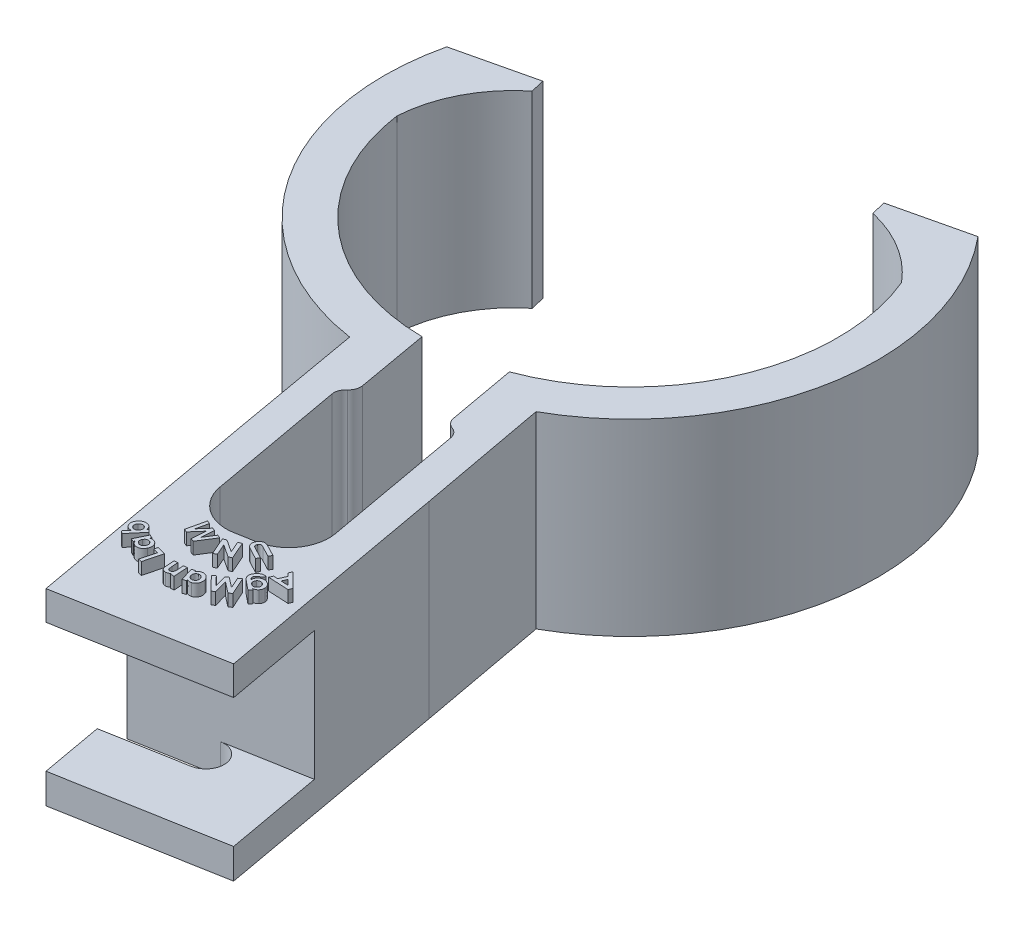
from build123d import *

# Parameters (mm, degrees)
BOSS_EXTRUDE6_DEPTH = 47
SKETCH13_W          = 40.343621174
SKETCH13_H          = 7.5
SKETCH13_H_2        = 7.3
BOSS_EXTRUDE7_DEPTH = 25
CUT_EXTRUDE4_DEPTH  = 25
BOSS_EXTRUDE8_DEPTH = 3
CUT_EXTRUDE6_DEPTH  = 1


with BuildPart() as part:
    # Sketch2 → Boss-Extrude6 (new body)
    with BuildSketch(Plane(origin=(0, 0, 0), x_dir=(1, 0, 0), z_dir=(0, 1, 0))):
        with BuildLine():
            Line((21.616767651, -30.12337147), (2.207227705, -34.69426381))
            ThreePointArc((2.207227705, -34.69426381), (11.158636297, -83.205582289), (52.844737245, -109.582555657))
            Line((52.844737245, -109.582555657), (58.60163644, -142.366081476))
            Line((58.60163644, -142.366081476), (64.895817981, -177.296582688))
            Line((64.895817981, -177.296582688), (104.60001041, -170.142222274))
            Line((104.60001041, -170.142222274), (98.305828869, -135.211721063))
            Line((98.305828869, -135.211721063), (92.25495319, -102.44626102))
            ThreePointArc((92.25495319, -102.44626102), (122.71490473, -59.986311861), (109.583052227, -9.407557624))
            Line((109.583052227, -9.407557624), (90.562090244, -13.886940941))
            Line((90.562090244, -13.886940941), (91.408224888, -17.47991206))
            ThreePointArc((91.408224888, -17.47991206), (101.619964374, -21.669899318), (109.972651715, -28.885731268))
            ThreePointArc((109.972651715, -28.885731268), (109.63860953, -69.322629119), (80.318906443, -97.172392186))
            Line((80.318906443, -97.172392186), (83.379216775, -114.155994828))
            ThreePointArc((83.379216775, -114.155994828), (84.040774134, -115.560944533), (85.316174374, -116.446888121))
            ThreePointArc((85.316174374, -116.446888121), (86.591575083, -117.332832261), (87.25313223, -118.737782838))
            Line((87.25313223, -118.737782838), (88.449913494, -125.379499334))
            Line((88.449913494, -125.379499334), (93.583336908, -153.868199831))
            ThreePointArc((93.583336908, -153.868199831), (91.954779092, -161.346598269), (85.515188569, -165.483060243))
            Line((85.515188569, -165.483060243), (80.718257555, -166.34742673))
            ThreePointArc((80.718257555, -166.34742673), (73.239859117, -164.718868914), (69.103397144, -158.279278391))
            Line((69.103397144, -158.279278391), (63.969973729, -129.790577894))
            Line((63.969973729, -129.790577894), (62.946566655, -124.111027375))
            ThreePointArc((62.946566655, -124.111027375), (63.076116611, -122.56352663), (63.962060397, -121.288126553))
            ThreePointArc((63.962060397, -121.288126553), (64.846046762, -120.018151398), (64.979577792, -118.476581338))
            Line((64.979577792, -118.476581338), (61.804045473, -100.456781006))
            ThreePointArc((61.804045473, -100.456781006), (28.076907465, -87.636520169), (10.926688095, -55.89145911))
            ThreePointArc((10.926688095, -55.89145911), (14.320642098, -43.523605025), (22.433244924, -33.590407462))
            Line((22.433244924, -33.590407462), (21.616767651, -30.12337147))
        make_face()
    extrude(amount=BOSS_EXTRUDE6_DEPTH)

    # Sketch13 → Boss-Extrude7 (add)
    with BuildSketch(Plane(origin=(32.983508727, 0, 183.046911508), x_dir=(0.9841504375270943, 0, -0.17733560363116313), z_dir=(0.17733560363116313, 0, 0.9841504375270943))):
        with Locations((52.598061734, 3.75)):
            Rectangle(SKETCH13_W, SKETCH13_H)
        with Locations((52.598061734, 43.35)):
            Rectangle(SKETCH13_W, SKETCH13_H_2)
    extrude(amount=BOSS_EXTRUDE7_DEPTH)

    # Sketch14 → Cut-Extrude4 (cut)
    with BuildSketch(Plane(origin=(0, 7.5, 0), x_dir=(1, 0, 0), z_dir=(0, 1, 0))):
        with BuildLine():
            Line((64.895817981, -177.296582688), (84.747914196, -173.719402481))
            ThreePointArc((84.747914196, -173.719402481), (90.05877622, -177.408540456), (86.369638245, -182.719402481))
            Line((86.369638245, -182.719402481), (66.51754203, -186.296582688))
            Line((66.51754203, -186.296582688), (64.895817981, -177.296582688))
        make_face()
    extrude(amount=-CUT_EXTRUDE4_DEPTH, mode=Mode.SUBTRACT)

    # Sketch15 → Boss-Extrude8 (add)
    # profile 1 of 11: a face of its own
    with BuildSketch(Plane(origin=(0, 47, 0), x_dir=(1, 0, 0), z_dir=(0, 1, 0))):
        Polygon((103.131089791, -174.061415074), (102.759973505, -174.89905029), (97.677874647, -174.645279256), (98.058531197, -173.786655458), (99.103190151, -173.842943018), (99.887399887, -172.072269942), (99.150891474, -171.322405158), (99.531548024, -170.46378136), align=None)
        Polygon((101.791636666, -173.975552694), (100.558080476, -172.737226372), (100.045768276, -173.891598367), align=None, mode=Mode.SUBTRACT)
    # profile 2 of 11: a face of its own
    with BuildSketch(Plane(origin=(0, 47, 0), x_dir=(1, 0, 0), z_dir=(0, 1, 0))):
        with BuildLine():
            Line((98.434764, -179.340757898), (97.881428664, -180.021932778))
            Line((97.881428664, -180.021932778), (95.547879986, -178.126282237))
            add(Edge.make_bspline(
                [(95.547879986, -178.126282237), (95.49262528, -178.080173686), (95.385900681, -177.991114907), (95.240154198, -177.851577211), (95.113939052, -177.711700262), (95.004398912, -177.573849013), (94.91348911, -177.435968968), (94.84280907, -177.297925003), (94.788253865, -177.16075703), (94.767278949, -177.06733653), (94.756992065, -177.021519617)],
                knots=[0, 0, 0, 0, 1.245890263, 2.406440056, 3.49025294, 4.505912215, 5.452835617, 6.344342255, 7.188003406, 8, 8, 8, 8], degree=3))
            add(Edge.make_bspline(
                [(94.756992065, -177.021519617), (94.747649854, -176.960606268), (94.729037447, -176.839249131), (94.731670478, -176.654040109), (94.755207077, -176.468492987), (94.8040957, -176.282384277), (94.875167925, -176.095655364), (94.96995744, -175.908688123), (95.087350516, -175.720845961), (95.18101065, -175.6014118), (95.229235154, -175.539916552)],
                knots=[0, 0, 0, 0, 0.919071591, 1.831058366, 2.755441493, 3.707028417, 4.697703049, 5.734317248, 6.83342655, 8, 8, 8, 8], degree=3))
            add(Edge.make_bspline(
                [(95.229235154, -175.539916552), (95.282327691, -175.476710114), (95.384472702, -175.355106916), (95.547305345, -175.19376925), (95.708248114, -175.05649453), (95.871372276, -174.946154627), (96.035924262, -174.859853208), (96.202114609, -174.792536018), (96.372074537, -174.747787419), (96.544603082, -174.722740605), (96.719103988, -174.718047968), (96.894512202, -174.733435768), (97.07084904, -174.769462973), (97.185075929, -174.80966796), (97.243184974, -174.830120879)],
                knots=[0, 0, 0, 0, 1.289499851, 2.480875545, 3.577954968, 4.591129442, 5.551536002, 6.477223281, 7.387410485, 8.291306844, 9.196200121, 10.109191889, 11.038115683, 12, 12, 12, 12], degree=3))
            Line((97.243184974, -174.830120879), (96.630699998, -175.583801769))
            add(Edge.make_bspline(
                [(96.630699998, -175.583801769), (96.59813572, -175.586056949), (96.532586706, -175.590596428), (96.435398769, -175.614562324), (96.33956703, -175.651295192), (96.244883727, -175.700272187), (96.15126934, -175.762019969), (96.06032646, -175.837966794), (95.969824589, -175.925901423), (95.914279547, -175.992229352), (95.885605346, -176.026470038)],
                knots=[0, 0, 0, 0, 0.874978427, 1.761254308, 2.674544752, 3.625293698, 4.617420731, 5.678829307, 6.801734371, 8, 8, 8, 8], degree=3))
            add(Edge.make_bspline(
                [(95.885605346, -176.026470038), (95.851019056, -176.071003595), (95.785066751, -176.155924256), (95.704573354, -176.286875157), (95.644303525, -176.412807177), (95.607877214, -176.534702107), (95.5904492, -176.650389718), (95.588723895, -176.759105846), (95.604123771, -176.860967918), (95.630297438, -176.941247091), (95.662646837, -177.002826002), (95.694861225, -177.051521048), (95.733504259, -177.104179443), (95.781990146, -177.157830236), (95.836360549, -177.215761393), (95.899643263, -177.275690629), (95.971072648, -177.338135196), (96.021626382, -177.380335779), (96.047789841, -177.402176168)],
                knots=[0, 0, 0, 0, 1.668457493, 3.181567445, 4.542185934, 5.790354604, 6.932873067, 7.996883218, 8.996938763, 9.97058257, 10.480159794, 11.05211696, 11.698033319, 12.41194827, 13.191175115, 14.050272592, 14.990942715, 16, 16, 16, 16], degree=3))
            add(Edge.make_bspline(
                [(96.047789841, -177.402176168), (96.04358753, -177.349105459), (96.035389394, -177.245571764), (96.040472981, -177.093419533), (96.059096079, -176.9494703), (96.093003851, -176.812461472), (96.142476118, -176.680528885), (96.206955076, -176.551221611), (96.286625524, -176.423731029), (96.348879028, -176.342704927), (96.38074507, -176.301229653)],
                knots=[0, 0, 0, 0, 1.078430529, 2.103870481, 3.079345661, 4.015832006, 4.958157072, 5.929662638, 6.94024509, 8, 8, 8, 8], degree=3))
            add(Edge.make_bspline(
                [(96.38074507, -176.301229653), (96.418278483, -176.257080089), (96.492150579, -176.170186289), (96.61794174, -176.056892491), (96.749322231, -175.956641128), (96.889962901, -175.873069258), (97.0384376, -175.805194525), (97.195081736, -175.752364303), (97.359762501, -175.71538731), (97.530646219, -175.693670597), (97.703796821, -175.687734847), (97.875784061, -175.69913707), (98.044825443, -175.728124375), (98.210871246, -175.773675856), (98.373573845, -175.837725416), (98.533124172, -175.918316501), (98.690400211, -176.015401473), (98.789072949, -176.092294687), (98.839271212, -176.131412947)],
                knots=[0, 0, 0, 0, 1.009761267, 1.987380712, 2.945913594, 3.888667412, 4.834370373, 5.788624284, 6.766935915, 7.773523073, 8.789178766, 9.784329507, 10.774691632, 11.775930393, 12.782334123, 13.819276532, 14.890589914, 16, 16, 16, 16], degree=3))
            add(Edge.make_bspline(
                [(98.839271212, -176.131412947), (98.890940946, -176.175389825), (98.992303902, -176.261661343), (99.127892117, -176.403078532), (99.244908147, -176.550994848), (99.345408459, -176.703845613), (99.425818658, -176.86414838), (99.487709872, -177.030264454), (99.534323457, -177.201651337), (99.548580359, -177.319234752), (99.55574507, -177.378325507)],
                knots=[0, 0, 0, 0, 1.101110583, 2.160100602, 3.17450141, 4.159786826, 5.124967143, 6.079161231, 7.034695401, 8, 8, 8, 8], degree=3))
            add(Edge.make_bspline(
                [(99.55574507, -177.378325507), (99.559296575, -177.43204323), (99.566272818, -177.537561286), (99.559322601, -177.694529851), (99.537331453, -177.846594865), (99.500909408, -177.994223349), (99.450346878, -178.137367507), (99.383701604, -178.275031386), (99.303730157, -178.408663559), (99.239865053, -178.491636287), (99.207525418, -178.533651528)],
                knots=[0, 0, 0, 0, 1.042406616, 2.047605787, 3.037430777, 4.014712394, 4.989076456, 5.972881294, 6.973519569, 8, 8, 8, 8], degree=3))
            add(Edge.make_bspline(
                [(99.207525418, -178.533651528), (99.17481301, -178.571493567), (99.11000284, -178.646466614), (99.001487409, -178.747074975), (98.884678322, -178.835060111), (98.759027727, -178.911663096), (98.622180136, -178.975979239), (98.472215724, -179.028330037), (98.308316793, -179.069371163), (98.193569547, -179.087272307), (98.134245671, -179.096527129)],
                knots=[0, 0, 0, 0, 0.964560943, 1.910998314, 2.848523608, 3.781883668, 4.745253494, 5.760155555, 6.8420092, 8, 8, 8, 8], degree=3))
            Line((98.134245671, -179.096527129), (98.434764, -179.340757898))
        make_face()
        with BuildLine():
            add(Edge.make_bspline(
                [(98.441442185, -178.170167454), (98.462291368, -178.143177128), (98.503220833, -178.090191856), (98.555086361, -178.005985359), (98.595940434, -177.919279887), (98.629322045, -177.831530721), (98.650612099, -177.741006673), (98.664807139, -177.649126855), (98.667048891, -177.555038547), (98.660727829, -177.460073885), (98.643769529, -177.366137029), (98.621310794, -177.273987207), (98.585290312, -177.186998257), (98.544402214, -177.10228596), (98.491352098, -177.023300672), (98.432890944, -176.945775978), (98.362213878, -176.874756833), (98.311023258, -176.830388505), (98.284981849, -176.807817694)],
                knots=[0, 0, 0, 0, 1.065665555, 2.09203029, 3.083576218, 4.058589778, 5.020594072, 5.985009344, 6.959668104, 7.956184716, 8.954732157, 9.940881604, 10.913713639, 11.891763056, 12.876107102, 13.882245919, 14.922667826, 16, 16, 16, 16], degree=3))
            add(Edge.make_bspline(
                [(98.284981849, -176.807817694), (98.256738695, -176.785975407), (98.201252747, -176.743064477), (98.113097532, -176.68900329), (98.023723932, -176.643272468), (97.932305852, -176.608044738), (97.839274431, -176.582791276), (97.744491949, -176.56893597), (97.648366927, -176.562616727), (97.551172441, -176.567786669), (97.455375894, -176.582013709), (97.362647008, -176.604782042), (97.27394087, -176.636422057), (97.18943783, -176.677671129), (97.109509176, -176.728789018), (97.032404578, -176.787218976), (96.959394812, -176.854952978), (96.91605878, -176.906546581), (96.894011296, -176.932795158)],
                knots=[0, 0, 0, 0, 1.094816154, 2.150854411, 3.167619202, 4.171520489, 5.151424491, 6.118811492, 7.10607238, 8.102548541, 9.09888137, 10.073915043, 11.027623138, 11.983325815, 12.952482788, 13.934134193, 14.948977507, 16, 16, 16, 16], degree=3))
            add(Edge.make_bspline(
                [(96.894011296, -176.932795158), (96.873394744, -176.959101849), (96.832775725, -177.010931659), (96.7829119, -177.094267588), (96.740711738, -177.178378051), (96.71076282, -177.265614399), (96.686910576, -177.35401001), (96.674988406, -177.445055267), (96.672040554, -177.53773934), (96.678779924, -177.631395339), (96.694789488, -177.724809535), (96.720813656, -177.815459433), (96.755294049, -177.903682901), (96.800461696, -177.988010898), (96.853866994, -178.069929093), (96.918115473, -178.147010679), (96.989055407, -178.223516511), (97.043570049, -178.26900866), (97.071460214, -178.292282838)],
                knots=[0, 0, 0, 0, 1.041142243, 2.051273015, 3.022449126, 3.969587443, 4.921953604, 5.872718237, 6.825084399, 7.80918361, 8.795428516, 9.774720375, 10.745086243, 11.743074639, 12.752377735, 13.788407955, 14.868530275, 16, 16, 16, 16], degree=3))
            add(Edge.make_bspline(
                [(97.071460214, -178.292282838), (97.099785202, -178.313997104), (97.155352496, -178.35659564), (97.242257516, -178.41242524), (97.331124283, -178.457563652), (97.421586137, -178.491644843), (97.512584424, -178.51840036), (97.605522867, -178.533229933), (97.699475581, -178.539104699), (97.793762445, -178.535176667), (97.886894449, -178.522190222), (97.977160648, -178.498715954), (98.064453453, -178.467611242), (98.147609663, -178.426011984), (98.227481722, -178.376266328), (98.303104728, -178.316597618), (98.374881302, -178.247497033), (98.418950279, -178.196298261), (98.441442185, -178.170167454)],
                knots=[0, 0, 0, 0, 1.1082415, 2.174122053, 3.203355073, 4.197583973, 5.173090473, 6.14413629, 7.113925413, 8.092577187, 9.070381234, 10.028633271, 10.984744872, 11.943302296, 12.910724419, 13.902644639, 14.929552671, 16, 16, 16, 16], degree=3))
        make_face(mode=Mode.SUBTRACT)
    # profile 3 of 11: a face of its own
    with BuildSketch(Plane(origin=(0, 47, 0), x_dir=(1, 0, 0), z_dir=(0, 1, 0))):
        Polygon((96.729398936, -182.634954046), (95.993844549, -183.131047796), (93.225259814, -180.994028565), (94.156389621, -184.370328145), (93.432283552, -184.858789683), (90.104639321, -181.360374719), (90.828745391, -180.871913181), (92.934281749, -183.078576342), (92.092830427, -180.019967568), (92.755878804, -179.572529166), (95.265922374, -181.506340765), (94.017101761, -178.722491606), (94.748840042, -178.229259936), align=None)
    # profile 4 of 11: a face of its own
    with BuildSketch(Plane(origin=(0, 47, 0), x_dir=(1, 0, 0), z_dir=(0, 1, 0))):
        with BuildLine():
            Line((88.149768954, -185.654259944), (87.31404179, -185.910893056))
            Line((87.31404179, -185.910893056), (86.286555312, -182.569892456))
            Line((86.286555312, -182.569892456), (87.122282475, -182.313259343))
            Line((87.122282475, -182.313259343), (87.23104149, -182.666249126))
            add(Edge.make_bspline(
                [(87.23104149, -182.666249126), (87.260139586, -182.617082413), (87.316496283, -182.521857159), (87.411735074, -182.391366165), (87.511313659, -182.276356211), (87.617961787, -182.177348948), (87.731730035, -182.092598599), (87.85403757, -182.019932861), (87.984557357, -181.956930407), (88.077188984, -181.926195395), (88.12401024, -181.910660184)],
                knots=[0, 0, 0, 0, 1.140955895, 2.209783996, 3.222920928, 4.176084696, 5.111376395, 6.051769194, 7.015254131, 8, 8, 8, 8], degree=3))
            add(Edge.make_bspline(
                [(88.12401024, -181.910660184), (88.177491579, -181.895805408), (88.283366895, -181.866397877), (88.445393551, -181.843304838), (88.60688139, -181.835818561), (88.767678092, -181.848145425), (88.928045451, -181.87541333), (89.087337908, -181.9217114), (89.24508703, -181.986883179), (89.401477524, -182.065831363), (89.5508132, -182.160627268), (89.69020614, -182.267747601), (89.816779222, -182.387653561), (89.930748051, -182.520053094), (90.032521838, -182.664570283), (90.11994192, -182.822453263), (90.197141332, -182.991282482), (90.23697795, -183.110414696), (90.257213365, -183.170929114)],
                knots=[0, 0, 0, 0, 0.965835011, 1.912033005, 2.843313872, 3.776158024, 4.714935254, 5.67199629, 6.658321753, 7.683788248, 8.719419839, 9.734181232, 10.741052379, 11.750297076, 12.7721076, 13.813587427, 14.889389511, 16, 16, 16, 16], degree=3))
            add(Edge.make_bspline(
                [(90.257213365, -183.170929114), (90.275093214, -183.234279728), (90.310194017, -183.358646403), (90.344475684, -183.546340643), (90.362051148, -183.729891847), (90.362263775, -183.90912879), (90.345140165, -184.08397587), (90.310501099, -184.254222746), (90.259742682, -184.420508795), (90.192387102, -184.580533972), (90.110687396, -184.731339828), (90.017923895, -184.870414563), (89.914849053, -184.996551044), (89.798983257, -185.107802657), (89.673105289, -185.206639094), (89.53543494, -185.290596685), (89.387731418, -185.362477508), (89.282963486, -185.397803065), (89.229726886, -185.415753333)],
                knots=[0, 0, 0, 0, 1.145736254, 2.249250627, 3.317120969, 4.352641516, 5.365391375, 6.371031144, 7.372974538, 8.388053151, 9.389062661, 10.355106048, 11.295266053, 12.219488455, 13.146642511, 14.076438695, 15.02256483, 16, 16, 16, 16], degree=3))
            add(Edge.make_bspline(
                [(89.229726886, -185.415753333), (89.18003591, -185.429532916), (89.081329641, -185.456904711), (88.930242778, -185.478983623), (88.779411784, -185.487345471), (88.629144736, -185.478233476), (88.479113302, -185.454507201), (88.330098672, -185.413740742), (88.181095082, -185.358473887), (88.085118944, -185.310458976), (88.036239807, -185.286005737)],
                knots=[0, 0, 0, 0, 1.002346291, 1.991062953, 2.96364028, 3.936552066, 4.913997217, 5.913494597, 6.937375622, 8, 8, 8, 8], degree=3))
            Line((88.036239807, -185.286005737), (88.149768954, -185.654259944))
        make_face()
        with BuildLine():
            add(Edge.make_bspline(
                [(88.819495516, -184.694509343), (88.85089998, -184.683995108), (88.912951567, -184.663220198), (89.000363597, -184.621922169), (89.081966788, -184.573955574), (89.15562768, -184.517615809), (89.223913873, -184.455109992), (89.283571249, -184.384018762), (89.337643487, -184.306294028), (89.3836297, -184.221607327), (89.423349254, -184.132664161), (89.451195882, -184.039488148), (89.472319701, -183.944566101), (89.480830255, -183.846907685), (89.482678742, -183.747239483), (89.471901769, -183.645538837), (89.454687885, -183.540871361), (89.434618098, -183.471596688), (89.424348281, -183.436148465)],
                knots=[0, 0, 0, 0, 1.015989207, 2.007477124, 2.961882744, 3.916737695, 4.849371931, 5.798218297, 6.759639321, 7.751559773, 8.752805912, 9.744101532, 10.732170598, 11.732797728, 12.748223852, 13.787724671, 14.867966786, 16, 16, 16, 16], degree=3))
            add(Edge.make_bspline(
                [(89.424348281, -183.436148465), (89.412453169, -183.400982787), (89.389195342, -183.332225361), (89.346370582, -183.234073095), (89.295384551, -183.144490853), (89.238922485, -183.061279217), (89.174893419, -182.985870842), (89.10403055, -182.91805541), (89.0268675, -182.857100836), (88.943560649, -182.80443766), (88.856554571, -182.759575028), (88.767207393, -182.725113673), (88.677109591, -182.700133054), (88.585718465, -182.684367118), (88.492876445, -182.679958015), (88.398974121, -182.684909218), (88.303804965, -182.698707369), (88.241509473, -182.716408978), (88.209872619, -182.725398766)],
                knots=[0, 0, 0, 0, 1.132900767, 2.215095631, 3.262603083, 4.274979311, 5.280491259, 6.275973029, 7.264425546, 8.276941377, 9.279779024, 10.247811145, 11.194534946, 12.129692445, 13.072526608, 14.025055084, 14.997021423, 16, 16, 16, 16], degree=3))
            add(Edge.make_bspline(
                [(88.209872619, -182.725398766), (88.177855125, -182.73628039), (88.114971778, -182.757652238), (88.02567547, -182.798959997), (87.943546903, -182.847580005), (87.867880778, -182.903638738), (87.799504056, -182.967398223), (87.737779165, -183.038734412), (87.683545538, -183.117333696), (87.635927095, -183.201803557), (87.596643186, -183.29154238), (87.567365374, -183.385010319), (87.546730155, -183.481100507), (87.537607003, -183.58030883), (87.537593774, -183.682197816), (87.547558044, -183.78685187), (87.566207622, -183.894305158), (87.586836821, -183.965482454), (87.597387644, -184.001886145)],
                knots=[0, 0, 0, 0, 1.021701037, 2.006652379, 2.967813816, 3.902210814, 4.847668477, 5.78817722, 6.748184224, 7.729516742, 8.715358998, 9.703448404, 10.685722158, 11.680522559, 12.709119598, 13.761343169, 14.855036954, 16, 16, 16, 16], degree=3))
            add(Edge.make_bspline(
                [(87.597387644, -184.001886145), (87.609327491, -184.03703236), (87.632766462, -184.10602747), (87.675110743, -184.204709377), (87.726373225, -184.294491353), (87.782577722, -184.377319895), (87.845866906, -184.452180332), (87.915825922, -184.518999278), (87.991801344, -184.579026644), (88.074156054, -184.630039216), (88.161172535, -184.67159584), (88.24989039, -184.705685303), (88.341159161, -184.728823921), (88.434025709, -184.740547985), (88.528277965, -184.745146125), (88.624129942, -184.737713552), (88.721952828, -184.721823002), (88.786568534, -184.703729474), (88.819495516, -184.694509343)],
                knots=[0, 0, 0, 0, 1.12971775, 2.217735279, 3.262299636, 4.271831475, 5.260875686, 6.239874229, 7.211957361, 8.203130841, 9.181554967, 10.143415305, 11.091885507, 12.039218957, 12.988627187, 13.958973766, 14.959930347, 16, 16, 16, 16], degree=3))
        make_face(mode=Mode.SUBTRACT)
    # profile 5 of 11: a face of its own
    with BuildSketch(Plane(origin=(0, 47, 0), x_dir=(1, 0, 0), z_dir=(0, 1, 0))):
        with BuildLine():
            Line((85.641722711, -186.22484162), (84.765926437, -186.276359048))
            Line((84.765926437, -186.276359048), (84.744937856, -185.918599132))
            add(Edge.make_bspline(
                [(84.744937856, -185.918599132), (84.699035742, -185.960868319), (84.611324576, -186.041637576), (84.477785411, -186.147466846), (84.350767529, -186.2351998), (84.226658796, -186.30148145), (84.105300722, -186.354009003), (83.9823104, -186.39006711), (83.858218514, -186.418667392), (83.773888541, -186.425560066), (83.731761774, -186.429003279)],
                knots=[0, 0, 0, 0, 1.290363585, 2.465666303, 3.522067167, 4.47863405, 5.371777645, 6.252012699, 7.126798549, 8, 8, 8, 8], degree=3))
            add(Edge.make_bspline(
                [(83.731761774, -186.429003279), (83.688828313, -186.430437463), (83.604433931, -186.433256641), (83.479662374, -186.423742717), (83.359753353, -186.401153297), (83.243442276, -186.369084692), (83.131302355, -186.324176386), (83.024459804, -186.265820037), (82.920103574, -186.198739585), (82.856651716, -186.144523387), (82.824482627, -186.117036632)],
                knots=[0, 0, 0, 0, 1.04512031, 2.054394869, 3.03823584, 4.011144736, 4.98715888, 5.970695285, 6.97117458, 8, 8, 8, 8], degree=3))
            add(Edge.make_bspline(
                [(82.824482627, -186.117036632), (82.798334633, -186.091920372), (82.745495543, -186.041166178), (82.678401278, -185.952124285), (82.618406319, -185.854865487), (82.570322273, -185.746242036), (82.528867802, -185.629060458), (82.498158406, -185.501410136), (82.474622068, -185.364708784), (82.467516297, -185.269953836), (82.463860632, -185.221205803)],
                knots=[0, 0, 0, 0, 0.8770409, 1.772298231, 2.69185288, 3.639911586, 4.643703877, 5.699366776, 6.816406439, 8, 8, 8, 8], degree=3))
            Line((82.463860632, -185.221205803), (82.326480824, -182.905783627))
            Line((82.326480824, -182.905783627), (83.19655294, -182.854266199))
            Line((83.19655294, -182.854266199), (83.288139478, -184.390248771))
            add(Edge.make_bspline(
                [(83.288139478, -184.390248771), (83.291045663, -184.440514349), (83.296586104, -184.536342189), (83.308801374, -184.673305394), (83.319637927, -184.797110474), (83.332170414, -184.907781622), (83.34480476, -185.005305181), (83.360522132, -185.089127033), (83.375138803, -185.160002863), (83.396018139, -185.235233189), (83.429278409, -185.3145505), (83.477779207, -185.398204295), (83.537440682, -185.468361789), (83.606206283, -185.526027548), (83.684304839, -185.569241799), (83.770311962, -185.597895679), (83.863557026, -185.612456626), (83.927611777, -185.611132938), (83.96072812, -185.610448591)],
                knots=[0, 0, 0, 0, 1.523599638, 2.904637165, 4.161047305, 5.284394294, 6.275223051, 7.136000069, 7.864616165, 8.464772841, 9.496000235, 10.458233831, 11.37995883, 12.26837496, 13.160120841, 14.063987946, 14.999080651, 16, 16, 16, 16], degree=3))
            add(Edge.make_bspline(
                [(83.96072812, -185.610448591), (84.003670006, -185.60573992), (84.088209822, -185.596469945), (84.207854288, -185.554266215), (84.316472393, -185.490582959), (84.412882464, -185.405883369), (84.496209317, -185.302286998), (84.562970037, -185.180959116), (84.615475292, -185.044264279), (84.635399145, -184.945885846), (84.645719106, -184.894928759)],
                knots=[0, 0, 0, 0, 0.962215422, 1.894316272, 2.807860964, 3.759243161, 4.744176424, 5.761654058, 6.840603739, 8, 8, 8, 8], degree=3))
            add(Edge.make_bspline(
                [(84.645719106, -184.894928759), (84.648217805, -184.879056555), (84.653791347, -184.843652384), (84.656297831, -184.783948617), (84.660011725, -184.712435745), (84.658846842, -184.628747878), (84.658796417, -184.533318519), (84.653899243, -184.426183722), (84.649994635, -184.307180716), (84.644682116, -184.223919209), (84.641903, -184.180362954)],
                knots=[0, 0, 0, 0, 0.53847272, 1.201104774, 2.001652466, 2.940211211, 4.006808565, 5.202099451, 6.536345604, 8, 8, 8, 8], degree=3))
            Line((84.641903, -184.180362954), (84.557948673, -182.773173952))
            Line((84.557948673, -182.773173952), (85.433744947, -182.721656524))
            Line((85.433744947, -182.721656524), (85.641722711, -186.22484162))
        make_face()
    # profile 6 of 11: a face of its own
    with BuildSketch(Plane(origin=(0, 47, 0), x_dir=(1, 0, 0), z_dir=(0, 1, 0))):
        Polygon((78.388518857, -187.157264484), (77.520354794, -186.929252164), (78.50013995, -183.196146695), (77.235100888, -182.864145493), (77.452618917, -182.036050541), (79.585822042, -182.596064063), align=None)
    # profile 7 of 11: a face of its own
    with BuildSketch(Plane(origin=(0, 47, 0), x_dir=(1, 0, 0), z_dir=(0, 1, 0))):
        with BuildLine():
            Line((73.001287802, -183.834922257), (72.214215987, -183.449495574))
            Line((72.214215987, -183.449495574), (73.755922718, -180.303116367))
            Line((73.755922718, -180.303116367), (74.542994533, -180.68854305))
            Line((74.542994533, -180.68854305), (74.379856011, -181.021498278))
            add(Edge.make_bspline(
                [(74.379856011, -181.021498278), (74.43495775, -181.005340383), (74.541667944, -180.974048955), (74.700620421, -180.943167121), (74.852375075, -180.928560002), (74.997938418, -180.928894428), (75.139321639, -180.946303053), (75.279125647, -180.974944415), (75.417130862, -181.021631107), (75.506250677, -181.062069238), (75.551400483, -181.08255597)],
                knots=[0, 0, 0, 0, 1.14315865, 2.21384454, 3.219007392, 4.17535866, 5.106269531, 6.051547028, 7.012876384, 8, 8, 8, 8], degree=3))
            add(Edge.make_bspline(
                [(75.551400483, -181.08255597), (75.600582065, -181.108673238), (75.697854262, -181.16032843), (75.83333794, -181.253095963), (75.954668132, -181.36027633), (76.06543913, -181.477585745), (76.162206014, -181.608569366), (76.245892209, -181.75161509), (76.319479341, -181.905955763), (76.37691624, -182.071656159), (76.422644811, -182.242984404), (76.448625819, -182.417373555), (76.459950501, -182.591720786), (76.452120824, -182.766668208), (76.425643489, -182.941544613), (76.383614452, -183.117320856), (76.323525628, -183.293360229), (76.270815439, -183.407631655), (76.24402368, -183.465714023)],
                knots=[0, 0, 0, 0, 0.967746749, 1.914026512, 2.846638518, 3.777675719, 4.714327398, 5.67112929, 6.655523265, 7.682059322, 8.716028715, 9.734176812, 10.742321893, 11.749602349, 12.772394009, 13.813068229, 14.88841698, 16, 16, 16, 16], degree=3))
            add(Edge.make_bspline(
                [(76.24402368, -183.465714023), (76.213892672, -183.524496117), (76.154694039, -183.63998577), (76.04994422, -183.799968267), (75.937131441, -183.946190937), (75.814813797, -184.077528869), (75.682600167, -184.193714649), (75.540420113, -184.294359465), (75.388954753, -184.38065464), (75.229683214, -184.451498247), (75.066855207, -184.506794961), (74.903485404, -184.544356485), (74.741404201, -184.564718962), (74.580546012, -184.567578779), (74.420782996, -184.553523487), (74.262691249, -184.520196062), (74.105339021, -184.471175987), (74.004477821, -184.424996967), (73.953406192, -184.401613963)],
                knots=[0, 0, 0, 0, 1.146696952, 2.252924714, 3.315868802, 4.35155095, 5.365377287, 6.367762299, 7.372199964, 8.38849128, 9.391165438, 10.354621772, 11.295339367, 12.223501417, 13.144203723, 14.074795349, 15.025161913, 16, 16, 16, 16], degree=3))
            add(Edge.make_bspline(
                [(73.953406192, -184.401613963), (73.907291532, -184.377881412), (73.81602025, -184.330909355), (73.691514881, -184.242355537), (73.575299671, -184.146026974), (73.471347076, -184.036606684), (73.377937967, -183.916132936), (73.298619805, -183.782908977), (73.226262321, -183.640933969), (73.190331818, -183.539329777), (73.172058535, -183.487656632)],
                knots=[0, 0, 0, 0, 1.005439258, 1.989990408, 2.958132362, 3.931689988, 4.913198655, 5.910400133, 6.937285977, 8, 8, 8, 8], degree=3))
            Line((73.172058535, -183.487656632), (73.001287802, -183.834922257))
        make_face()
        with BuildLine():
            add(Edge.make_bspline(
                [(74.148981612, -183.594507593), (74.179240948, -183.608539444), (74.238632135, -183.63608031), (74.331301143, -183.665337674), (74.423540252, -183.685967874), (74.516359632, -183.694856839), (74.6088077, -183.696941173), (74.701489287, -183.685403557), (74.794127295, -183.665427692), (74.886295886, -183.636068519), (74.975776503, -183.597004042), (75.06065493, -183.549188499), (75.140588049, -183.493707115), (75.214395208, -183.429031056), (75.283027451, -183.356498302), (75.346400426, -183.275809093), (75.403926074, -183.186533944), (75.437114227, -183.122553335), (75.454089785, -183.089827605)],
                knots=[0, 0, 0, 0, 1.020937892, 2.003834961, 2.970812237, 3.911212826, 4.856345908, 5.79780582, 6.764783096, 7.756956385, 8.756137207, 9.750747274, 10.737307566, 11.731774459, 12.751782111, 13.792610273, 14.870932284, 16, 16, 16, 16], degree=3))
            add(Edge.make_bspline(
                [(75.454089785, -183.089827605), (75.469601604, -183.056358017), (75.500132863, -182.990481239), (75.535449231, -182.889280814), (75.560231788, -182.788613384), (75.576101564, -182.6890369), (75.580524601, -182.589917687), (75.576171901, -182.491427772), (75.560489258, -182.393681325), (75.535602488, -182.297652989), (75.502992086, -182.205086437), (75.461365659, -182.11831979), (75.412793598, -182.037881095), (75.356261092, -181.963856604), (75.291582031, -181.897163396), (75.221079696, -181.835079657), (75.14097045, -181.78170572), (75.083572998, -181.751461182), (75.054352706, -181.736064083)],
                knots=[0, 0, 0, 0, 1.12222964, 2.208837287, 3.25575566, 4.274146232, 5.272190167, 6.270234102, 7.269497395, 8.278880186, 9.28603332, 10.251397205, 11.202489027, 12.141338882, 13.079140551, 14.026037412, 14.995081469, 16, 16, 16, 16], degree=3))
            add(Edge.make_bspline(
                [(75.054352706, -181.736064083), (75.02344179, -181.721784667), (74.963028508, -181.69387652), (74.86936211, -181.662851142), (74.775494041, -181.643480266), (74.681707383, -181.630806406), (74.58789886, -181.631633768), (74.494155213, -181.6408585), (74.400636602, -181.661453576), (74.307525108, -181.690670117), (74.217287542, -181.729538157), (74.131763121, -181.777744586), (74.05133945, -181.834062322), (73.976221639, -181.899648037), (73.90670086, -181.974491634), (73.841704457, -182.057641878), (73.782127614, -182.149524546), (73.748349024, -182.215616009), (73.731118031, -182.249330309)],
                knots=[0, 0, 0, 0, 1.026029865, 2.00530556, 2.966199252, 3.912781014, 4.852345186, 5.78725086, 6.748144552, 7.733595752, 8.72560105, 9.704313403, 10.688457885, 11.680555837, 12.704792413, 13.763450352, 14.859100648, 16, 16, 16, 16], degree=3))
            add(Edge.make_bspline(
                [(73.731118031, -182.249330309), (73.715590014, -182.283120305), (73.685144573, -182.349371608), (73.650175156, -182.450994898), (73.623376659, -182.550943251), (73.609894137, -182.650575205), (73.602948909, -182.748586222), (73.609459214, -182.845817336), (73.624713648, -182.941639221), (73.649174589, -183.03578208), (73.683770166, -183.12594723), (73.725328097, -183.211493331), (73.776570433, -183.290114053), (73.835364538, -183.362977946), (73.901002929, -183.431309061), (73.975959631, -183.492218332), (74.058893199, -183.547220457), (74.118470779, -183.578492549), (74.148981612, -183.594507593)],
                knots=[0, 0, 0, 0, 1.128497046, 2.212619396, 3.259506176, 4.264587697, 5.260863782, 6.237860769, 7.215763994, 8.204147171, 9.185144357, 10.143836682, 11.086641231, 12.027663913, 12.983677846, 13.957951058, 14.954227143, 16, 16, 16, 16], degree=3))
        make_face(mode=Mode.SUBTRACT)
    # profile 8 of 11: a face of its own
    with BuildSketch(Plane(origin=(0, 47, 0), x_dir=(1, 0, 0), z_dir=(0, 1, 0))):
        with BuildLine():
            Line((69.2527515, -182.964616321), (70.371824516, -181.645197751))
            add(Edge.make_bspline(
                [(70.371824516, -181.645197751), (70.317139046, -181.648562563), (70.209641944, -181.655176891), (70.050587897, -181.645444135), (69.897212724, -181.624055935), (69.749567863, -181.588035813), (69.60842688, -181.535864856), (69.473329303, -181.469576173), (69.34346331, -181.389490301), (69.263571144, -181.325510812), (69.22317668, -181.293161994)],
                knots=[0, 0, 0, 0, 1.064379495, 2.09228724, 3.091757978, 4.072520829, 5.040828109, 6.011442365, 6.99456074, 8, 8, 8, 8], degree=3))
            add(Edge.make_bspline(
                [(69.22317668, -181.293161994), (69.181639032, -181.255837855), (69.099835375, -181.182332225), (68.992683713, -181.058648556), (68.899130367, -180.927989774), (68.822814384, -180.787664621), (68.761363284, -180.639958774), (68.715352868, -180.484207855), (68.685016282, -180.320195155), (68.670003488, -180.149619606), (68.670786005, -179.976153648), (68.68856236, -179.803388026), (68.725713743, -179.633964582), (68.778089138, -179.466554411), (68.849298258, -179.302713615), (68.93690985, -179.141118924), (69.041850174, -178.982327283), (69.1233948, -178.88198995), (69.164981067, -178.830819746)],
                knots=[0, 0, 0, 0, 0.973895373, 1.917975774, 2.849737484, 3.77382915, 4.699519823, 5.637378976, 6.603029802, 7.60609987, 8.621897865, 9.626579242, 10.631444604, 11.644372228, 12.68370766, 13.744244975, 14.849606211, 16, 16, 16, 16], degree=3))
            add(Edge.make_bspline(
                [(69.164981067, -178.830819746), (69.207084385, -178.783276715), (69.290098791, -178.689536919), (69.426805648, -178.564941661), (69.570067794, -178.455865883), (69.719958544, -178.363296095), (69.876353317, -178.286137103), (70.039596232, -178.226211422), (70.208981317, -178.180522931), (70.383424073, -178.154134176), (70.557623719, -178.141328835), (70.728039032, -178.144470905), (70.892194581, -178.166100633), (71.050337224, -178.201890651), (71.2019925, -178.254749226), (71.347271113, -178.324052243), (71.486227132, -178.41017592), (71.572314731, -178.47853785), (71.615874997, -178.513128941)],
                knots=[0, 0, 0, 0, 1.108176017, 2.184972068, 3.223288206, 4.247975516, 5.256147617, 6.262789586, 7.279624308, 8.313879597, 9.33807036, 10.326649446, 11.283937676, 12.224067997, 13.152981934, 14.081829491, 15.029407023, 16, 16, 16, 16], degree=3))
            add(Edge.make_bspline(
                [(71.615874997, -178.513128941), (71.652784316, -178.546159706), (71.725294201, -178.611050011), (71.82183779, -178.719241473), (71.904471558, -178.834839893), (71.976507313, -178.957735862), (72.036355675, -179.090566348), (72.082193043, -179.235849973), (72.119308436, -179.392994211), (72.133340781, -179.502914085), (72.14058954, -179.559695948)],
                knots=[0, 0, 0, 0, 0.988277191, 1.941511422, 2.887657995, 3.820829088, 4.781308509, 5.789171842, 6.857941374, 8, 8, 8, 8], degree=3))
            Line((72.14058954, -179.559695948), (72.379096151, -179.278258147))
            Line((72.379096151, -179.278258147), (73.041190502, -179.840179722))
            Line((73.041190502, -179.840179722), (69.91484585, -183.526537895))
            Line((69.91484585, -183.526537895), (69.2527515, -182.964616321))
        make_face()
        with BuildLine():
            add(Edge.make_bspline(
                [(69.885271031, -180.795160191), (69.911609134, -180.816338219), (69.963261507, -180.857871027), (70.046036685, -180.910630927), (70.131293566, -180.953971993), (70.219027483, -180.987181548), (70.308765599, -181.011557446), (70.400905396, -181.025802623), (70.49553804, -181.030508727), (70.591690849, -181.025554424), (70.687793017, -181.011820894), (70.781193182, -180.986428462), (70.872283982, -180.953048338), (70.959503782, -180.908821942), (71.044547155, -180.856064186), (71.125467568, -180.792779759), (71.203299494, -180.719594442), (71.25152502, -180.665480384), (71.276241584, -180.637745828)],
                knots=[0, 0, 0, 0, 1.032391367, 2.024650861, 2.994032506, 3.950807999, 4.886868912, 5.831320201, 6.794836231, 7.777768197, 8.770265706, 9.755789518, 10.730759264, 11.730559877, 12.739251126, 13.785279814, 14.864910817, 16, 16, 16, 16], degree=3))
            add(Edge.make_bspline(
                [(71.276241584, -180.637745828), (71.299986592, -180.608563624), (71.346625576, -180.55124512), (71.406251421, -180.460169909), (71.458005395, -180.368731727), (71.496728335, -180.274515348), (71.526632447, -180.17975351), (71.547028418, -180.083952339), (71.556625204, -179.98669522), (71.555504957, -179.889169898), (71.544776652, -179.792781783), (71.526328863, -179.699210372), (71.497086693, -179.609895092), (71.45987351, -179.52433019), (71.413105913, -179.442817994), (71.355614795, -179.366444433), (71.291377795, -179.29210326), (71.24149039, -179.248132409), (71.216137918, -179.225786693)],
                knots=[0, 0, 0, 0, 1.13857226, 2.236337592, 3.292378211, 4.315409371, 5.314453275, 6.298485064, 7.275897305, 8.267860988, 9.246269017, 10.209487753, 11.150547131, 12.086319201, 13.031165158, 13.988444154, 14.97773969, 16, 16, 16, 16], degree=3))
            add(Edge.make_bspline(
                [(71.216137918, -179.225786693), (71.190428662, -179.20525483), (71.140025588, -179.16500205), (71.058987264, -179.113806832), (70.975023744, -179.072967852), (70.888201266, -179.040814574), (70.798226186, -179.019009975), (70.705489307, -179.006603638), (70.60992388, -179.00389154), (70.51276187, -179.010440482), (70.415773768, -179.026933267), (70.320473431, -179.051210894), (70.229115722, -179.08714479), (70.140591153, -179.130895048), (70.056048, -179.185320024), (69.974377811, -179.248164108), (69.894998838, -179.319861527), (69.84751916, -179.374409947), (69.823259312, -179.402281585)],
                knots=[0, 0, 0, 0, 1.005839428, 1.971951295, 2.92465114, 3.857074183, 4.798384379, 5.750339092, 6.71375403, 7.717945967, 8.723785395, 9.71941395, 10.720160965, 11.720671592, 12.735267998, 13.789739297, 14.870662321, 16, 16, 16, 16], degree=3))
            add(Edge.make_bspline(
                [(69.823259312, -179.402281585), (69.800204923, -179.430536142), (69.754950574, -179.485998101), (69.696385325, -179.57393907), (69.649108692, -179.664258273), (69.608556257, -179.755177395), (69.581080775, -179.848770756), (69.559729939, -179.943269456), (69.550837683, -180.039685994), (69.550724595, -180.136782171), (69.560029217, -180.23273414), (69.579289673, -180.325347565), (69.606815081, -180.414162491), (69.644841622, -180.498478739), (69.690201544, -180.579929474), (69.746074829, -180.656628541), (69.811657823, -180.728543791), (69.860404561, -180.772657236), (69.885271031, -180.795160191)],
                knots=[0, 0, 0, 0, 1.120086752, 2.198661429, 3.238982443, 4.24998225, 5.251398903, 6.230691392, 7.22238416, 8.219022579, 9.210715348, 10.178435578, 11.120966575, 12.06146953, 13.015277872, 13.980775782, 14.969962325, 16, 16, 16, 16], degree=3))
        make_face(mode=Mode.SUBTRACT)
    # profile 9 of 11: a face of its own
    with BuildSketch(Plane(origin=(0, 47, 0), x_dir=(1, 0, 0), z_dir=(0, 1, 0))):
        with BuildLine():
            Line((93.481149291, -169.38790589), (93.059469603, -170.19215018))
            Line((93.059469603, -170.19215018), (90.334770084, -168.761110517))
            add(Edge.make_bspline(
                [(90.334770084, -168.761110517), (90.306543344, -168.746646682), (90.25198392, -168.718689558), (90.171996941, -168.680815891), (90.097812561, -168.647162906), (90.028891409, -168.619029898), (89.964989977, -168.597429323), (89.906956849, -168.579666308), (89.853956107, -168.568139817), (89.791334, -168.55904661), (89.716371327, -168.558455563), (89.628948282, -168.571654499), (89.543958818, -168.600320608), (89.461756618, -168.641247198), (89.384394231, -168.695740618), (89.313630925, -168.763867955), (89.250577238, -168.845535126), (89.215595289, -168.906926861), (89.197570565, -168.938559435)],
                knots=[0, 0, 0, 0, 1.146176477, 2.215442797, 3.197996382, 4.090080463, 4.904208276, 5.635156351, 6.282132668, 6.862378703, 7.919782207, 8.977934933, 10.042806947, 11.147853875, 12.286167063, 13.448535618, 14.685337948, 16, 16, 16, 16], degree=3))
            add(Edge.make_bspline(
                [(89.197570565, -168.938559435), (89.180612248, -168.97311569), (89.147535891, -169.040515954), (89.116789449, -169.14627919), (89.098976547, -169.250797134), (89.100807667, -169.353532729), (89.115488847, -169.451211568), (89.143794083, -169.54179516), (89.183430072, -169.624635135), (89.229358132, -169.686953908), (89.275824448, -169.73393181), (89.319537296, -169.773234983), (89.374087179, -169.813461663), (89.437762472, -169.856508898), (89.510106624, -169.903249893), (89.592034369, -169.952828847), (89.683942853, -170.004168824), (89.748618684, -170.038665958), (89.782388774, -170.056678426)],
                knots=[0, 0, 0, 0, 1.262991443, 2.4634023, 3.606181798, 4.735110077, 5.824639205, 6.842895461, 7.843290932, 8.830051007, 9.36965181, 10.013738432, 10.760056398, 11.595021555, 12.540215605, 13.590688056, 14.7419925, 16, 16, 16, 16], degree=3))
            Line((89.782388774, -170.056678426), (92.406915517, -171.434292608))
            Line((92.406915517, -171.434292608), (91.984281803, -172.238536899))
            Line((91.984281803, -172.238536899), (89.474238233, -170.921026382))
            add(Edge.make_bspline(
                [(89.474238233, -170.921026382), (89.423224582, -170.894240317), (89.325445127, -170.84289863), (89.186736136, -170.765080193), (89.061260456, -170.692195551), (88.948903172, -170.623254961), (88.85005363, -170.558553799), (88.763699051, -170.499101782), (88.691665749, -170.442373828), (88.612407336, -170.372886265), (88.528076207, -170.278953263), (88.439647226, -170.155016928), (88.361633859, -170.015853282), (88.296460389, -169.864179786), (88.243311026, -169.705299071), (88.211754803, -169.543003861), (88.195020062, -169.381590133), (88.200607046, -169.219480633), (88.224515447, -169.055511567), (88.269952008, -168.889203549), (88.33116269, -168.718267136), (88.386716007, -168.607303121), (88.415268882, -168.550270673)],
                knots=[0, 0, 0, 0, 1.156924185, 2.217512647, 3.193341988, 4.070591231, 4.864053318, 5.56557028, 6.174919634, 6.704155527, 7.680507054, 8.701186773, 9.756205072, 10.877257426, 12.012137179, 13.112928545, 14.190565621, 15.263823466, 16.361052991, 17.510321255, 18.720373685, 20, 20, 20, 20], degree=3))
            add(Edge.make_bspline(
                [(88.415268882, -168.550270673), (88.435410539, -168.51307076), (88.475256797, -168.439478141), (88.543338707, -168.336086885), (88.615073206, -168.239054985), (88.691180759, -168.149081834), (88.772838883, -168.067226457), (88.857611179, -167.990800742), (88.948731079, -167.923673018), (89.042788933, -167.86233148), (89.139826982, -167.809643551), (89.236956863, -167.763162806), (89.334953319, -167.726451357), (89.432354868, -167.694921796), (89.530528737, -167.673545863), (89.628684264, -167.658808087), (89.726946614, -167.652292385), (89.827471946, -167.652963656), (89.933948583, -167.663705624), (90.049247284, -167.687510701), (90.175585365, -167.722395595), (90.313228686, -167.768385494), (90.461869117, -167.827181147), (90.622106526, -167.897124304), (90.79395633, -167.977865491), (90.910588731, -168.038785725), (90.971105721, -168.070395373)],
                knots=[0, 0, 0, 0, 1.018048639, 2.014006493, 2.977171501, 3.922212386, 4.84798356, 5.7591074, 6.66713787, 7.56969696, 8.460587705, 9.323673003, 10.159746216, 10.97821144, 11.786225136, 12.575560061, 13.365971057, 14.154600174, 14.993368316, 15.937819762, 16.985353544, 18.147487934, 19.429924024, 20.832352734, 22.356404622, 24, 24, 24, 24], degree=3))
            Line((90.971105721, -168.070395373), (93.481149291, -169.38790589))
        make_face()
    # profile 10 of 11: a face of its own
    with BuildSketch(Plane(origin=(0, 47, 0), x_dir=(1, 0, 0), z_dir=(0, 1, 0))):
        Polygon((88.970710351, -174.95207878), (88.179822431, -175.296482326), (85.074466361, -173.24914158), (86.317562815, -176.106450775), (85.491375916, -176.466118744), (83.602403561, -172.124344405), (84.396153561, -171.778986833), (87.493877419, -173.81774134), (86.255551097, -170.96997241), (87.081737996, -170.610304441), align=None)
    # profile 11 of 11: a face of its own
    with BuildSketch(Plane(origin=(0, 47, 0), x_dir=(1, 0, 0), z_dir=(0, 1, 0))):
        Polygon((80.458045874, -176.302917101), (79.641399239, -175.96519174), (79.895170273, -172.485857305), (77.598828626, -175.118970286), (76.794584335, -174.785061031), (77.872634215, -170.093158988), (78.676878506, -170.427068243), (78.000473758, -173.391228399), (80.081205429, -171.008070346), (80.817713842, -171.313358808), (80.591609575, -174.465462173), (82.219178686, -171.894360911), (83.032963241, -172.231132245), align=None)
    extrude(amount=BOSS_EXTRUDE8_DEPTH)

    # Sketch16 → Cut-Extrude6 (cut)
    # profile 1 of 3: a face of its own
    with BuildSketch(Plane(origin=(0, 0, 0), x_dir=(-1, 0, 0), z_dir=(0, -1, 0))):
        Polygon((-78.133027041, -198.332017789), (-83.811392426, -197.461945674), (-79.287399036, -190.304839303), (-82.420421873, -189.825918029), (-82.157110575, -188.110578486), (-76.421503604, -188.988282813), (-80.924508411, -196.093871755), (-77.862083532, -196.563252765), align=None)
    # profile 2 of 3: a face of its own
    with BuildSketch(Plane(origin=(0, 0, 0), x_dir=(-1, 0, 0), z_dir=(0, -1, 0))):
        Polygon((-85.425381898, -197.088341607), (-90.500802571, -196.147671535), (-90.178341633, -194.415159516), (-86.860237667, -195.029552545), (-86.549225047, -193.348557953), (-89.867329013, -192.734164925), (-89.552500287, -191.034089804), (-86.234396321, -191.648482833), (-85.780279734, -189.202359035), (-89.098383701, -188.587966006), (-88.775922763, -186.849729828), (-83.70050209, -187.790399901), align=None)
    # profile 3 of 3: a face of its own
    with BuildSketch(Plane(origin=(0, 0, 0), x_dir=(-1, 0, 0), z_dir=(0, -1, 0))):
        with BuildLine():
            Line((-92.42469629, -195.760802783), (-94.523554463, -195.306686197))
            add(Edge.make_bspline(
                [(-94.523554463, -195.306686197), (-94.686618379, -195.269548631), (-95.002524444, -195.197601491), (-95.456265575, -195.076661205), (-95.873471127, -194.944235572), (-96.255697904, -194.806362327), (-96.602174694, -194.658186281), (-96.912168951, -194.499290841), (-97.187980551, -194.335152224), (-97.429396453, -194.157969502), (-97.644800768, -193.967839963), (-97.840592361, -193.761097437), (-98.023734767, -193.538877946), (-98.188788197, -193.297980147), (-98.340487012, -193.040430698), (-98.477718441, -192.766623559), (-98.597726148, -192.473985909), (-98.704229047, -192.167340793), (-98.792520273, -191.847042888), (-98.856769805, -191.517224369), (-98.899275104, -191.17936096), (-98.917268824, -190.834459524), (-98.915968721, -190.482058981), (-98.890334449, -190.122723314), (-98.843371068, -189.755553267), (-98.79401624, -189.510397451), (-98.768972131, -189.385998096)],
                knots=[0, 0, 0, 0, 1.440864665, 2.791407803, 4.044432476, 5.21113231, 6.291169299, 7.288642984, 8.210582959, 9.053434143, 9.8648451, 10.682670181, 11.504305083, 12.343371203, 13.195787666, 14.078031365, 14.979684004, 15.918968086, 16.873474509, 17.839628834, 18.811593385, 19.804964333, 20.813277187, 21.845954764, 22.906973358, 24, 24, 24, 24], degree=3))
            add(Edge.make_bspline(
                [(-98.768972131, -189.385998096), (-98.727249845, -189.211371077), (-98.645102756, -188.867547609), (-98.464691792, -188.376588477), (-98.249284361, -187.915237134), (-97.994024258, -187.488224658), (-97.704874697, -187.100270927), (-97.389889253, -186.753938266), (-97.047238246, -186.455994585), (-96.683556598, -186.20400754), (-96.304246132, -186.001044304), (-95.919291872, -185.841708656), (-95.529504504, -185.735160361), (-95.196849104, -185.682013448), (-94.913497409, -185.670520173), (-94.66959556, -185.675264437), (-94.393278388, -185.692798112), (-94.085275029, -185.725832953), (-93.744916302, -185.774105213), (-93.373606988, -185.83779919), (-92.969732627, -185.914441181), (-92.690459859, -185.972671067), (-92.544903622, -186.003020331)],
                knots=[0, 0, 0, 0, 1.317901364, 2.594818502, 3.834182619, 5.053688215, 6.242265655, 7.383099573, 8.485833941, 9.570566694, 10.626183028, 11.640407091, 12.624260871, 13.588302432, 14.107426739, 14.705523164, 15.379612256, 16.140641608, 16.980430231, 17.90443528, 18.907797134, 20, 20, 20, 20], degree=3))
            Line((-92.544903622, -186.003020331), (-90.415516602, -186.462861077))
            Line((-90.415516602, -186.462861077), (-92.42469629, -195.760802783))
        make_face()
        with BuildLine():
            Line((-93.819482948, -193.671484875), (-92.552535833, -187.813762519))
            Line((-92.552535833, -187.813762519), (-93.374906626, -187.636313601))
            add(Edge.make_bspline(
                [(-93.374906626, -187.636313601), (-93.472720456, -187.615906293), (-93.661434767, -187.576534037), (-93.936400149, -187.530765853), (-94.192233053, -187.497741354), (-94.4297063, -187.47821824), (-94.648271831, -187.471595104), (-94.848273642, -187.47983074), (-95.029430637, -187.496283094), (-95.244638212, -187.543756689), (-95.497854171, -187.632938225), (-95.783086216, -187.794385865), (-96.0523412, -188.009741357), (-96.257620743, -188.228855849), (-96.413966313, -188.425963073), (-96.522183742, -188.590520921), (-96.621406159, -188.766891505), (-96.712736899, -188.954344712), (-96.797617715, -189.152332078), (-96.869182391, -189.364048571), (-96.934385492, -189.586822257), (-96.970404057, -189.740707555), (-96.98875879, -189.819126101)],
                knots=[0, 0, 0, 0, 1.225459775, 2.36430573, 3.418024736, 4.388495016, 5.285920598, 6.097829317, 6.84302326, 7.513187208, 8.796216331, 10.119936964, 11.513707001, 13.009088508, 13.792501611, 14.59737156, 15.421776494, 16.273056225, 17.153987506, 18.061863123, 19.012343118, 20, 20, 20, 20], degree=3))
            add(Edge.make_bspline(
                [(-96.98875879, -189.819126101), (-97.012398868, -189.939653953), (-97.058438319, -190.174383982), (-97.092240949, -190.523025065), (-97.097546776, -190.855779396), (-97.069814861, -191.173766022), (-97.01695119, -191.4778153), (-96.926717935, -191.765394083), (-96.81239942, -192.040235875), (-96.7086941, -192.207963306), (-96.656757588, -192.291962639)],
                knots=[0, 0, 0, 0, 1.1492386, 2.238161596, 3.274233812, 4.26018119, 5.222491868, 6.156650936, 7.076835015, 8, 8, 8, 8], degree=3))
            add(Edge.make_bspline(
                [(-96.656757588, -192.291962639), (-96.604085201, -192.365520775), (-96.497382672, -192.514533181), (-96.295712529, -192.710986066), (-96.065141041, -192.893511492), (-95.801039052, -193.05939825), (-95.502215981, -193.205776005), (-95.17171678, -193.336839539), (-94.808234327, -193.451723589), (-94.552637783, -193.511064096), (-94.420519607, -193.541737278)],
                knots=[0, 0, 0, 0, 0.825831064, 1.672949873, 2.563035733, 3.511757837, 4.51827113, 5.601435216, 6.760178835, 8, 8, 8, 8], degree=3))
            Line((-94.420519607, -193.541737278), (-93.819482948, -193.671484875))
        make_face(mode=Mode.SUBTRACT)
    extrude(amount=-CUT_EXTRUDE6_DEPTH, mode=Mode.SUBTRACT)


solid = part.part
